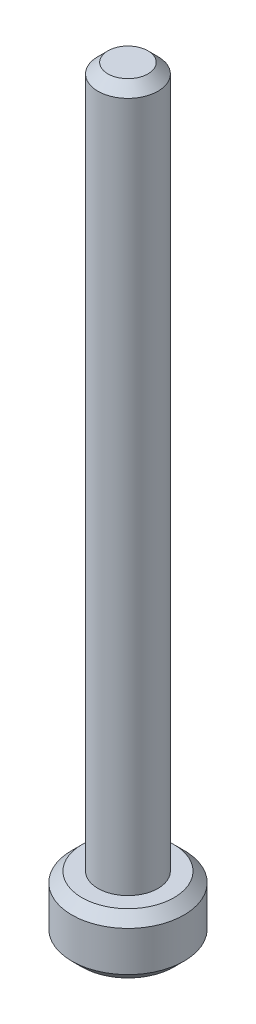
from build123d import *

# Parameters (mm, degrees)
SKETCH1_R           = 2.8
BOSS_EXTRUDE1_DEPTH = 1.5
SKETCH2_R           = 1.5
BOSS_EXTRUDE2_DEPTH = 35
CHAMFER1_SIZE       = 0.5
CHAMFER2_SIZE       = 0.5


with BuildPart() as part:
    # Sketch1 → Boss-Extrude1 (new, symmetric)
    with BuildSketch(Plane(origin=(0, 0, 0), x_dir=(1, 0, 0), z_dir=(0, 1, 0))):
        with Locations(Location((0, 0, 0), (0, 0, 270))):
            Circle(SKETCH1_R)
    extrude(amount=BOSS_EXTRUDE1_DEPTH, both=True)

    # Sketch2 → Boss-Extrude2 (add)
    with BuildSketch(Plane(origin=(0, 1.5, 0), x_dir=(1, 0, 0), z_dir=(0, 1, 0))):
        with Locations(Location((0, 0, 0), (0, 0, 270))):
            Circle(SKETCH2_R)
    extrude(amount=BOSS_EXTRUDE2_DEPTH)

    # Chamfer1
    chamfer1_edges = [part.edges().sort_by_distance(p)[0] for p in [
        (0, 36.5, -1.5),
    ]]
    chamfer(chamfer1_edges, length=CHAMFER1_SIZE)

    # Chamfer2
    chamfer2_edges = [part.edges().sort_by_distance(p)[0] for p in [
        (0, -1.5, -2.8),
        (0, 1.5, -2.8),
    ]]
    chamfer(chamfer2_edges, length=CHAMFER2_SIZE)


solid = part.part
